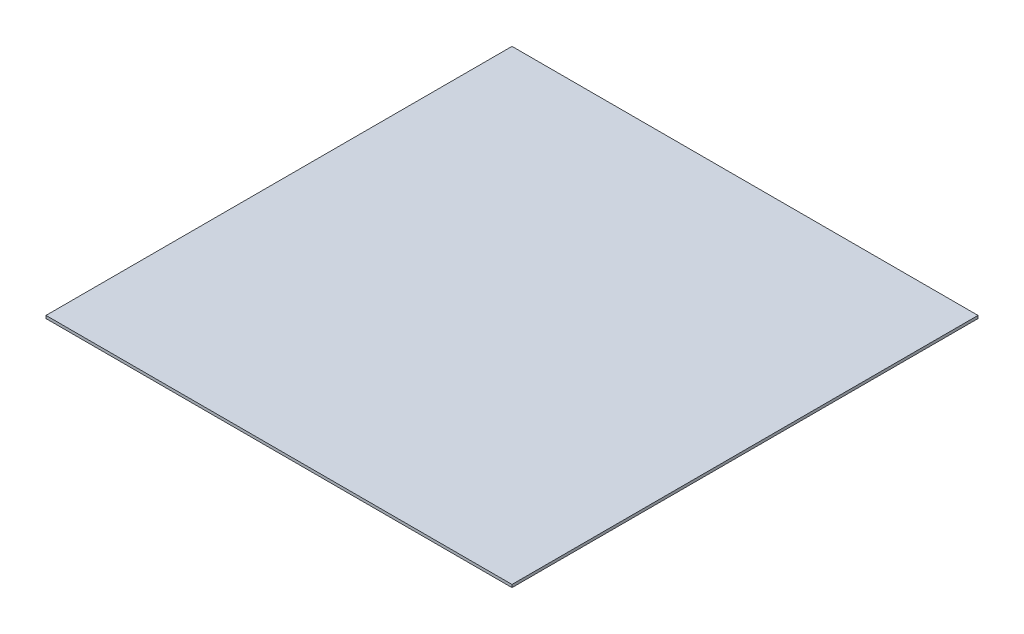
from build123d import *

# Parameters (mm, degrees)
SKETCH1_W           = 500
SKETCH1_H           = 500
BOSS_EXTRUDE1_DEPTH = 2.9972


with BuildPart() as part:
    # Sketch1 → Boss-Extrude1 (new body)
    with BuildSketch(Plane(origin=(0, 0, 0), x_dir=(1, 0, 0), z_dir=(0, 1, 0))):
        with Locations((250, -250)):
            Rectangle(SKETCH1_W, SKETCH1_H)
    extrude(amount=BOSS_EXTRUDE1_DEPTH)


solid = part.part
